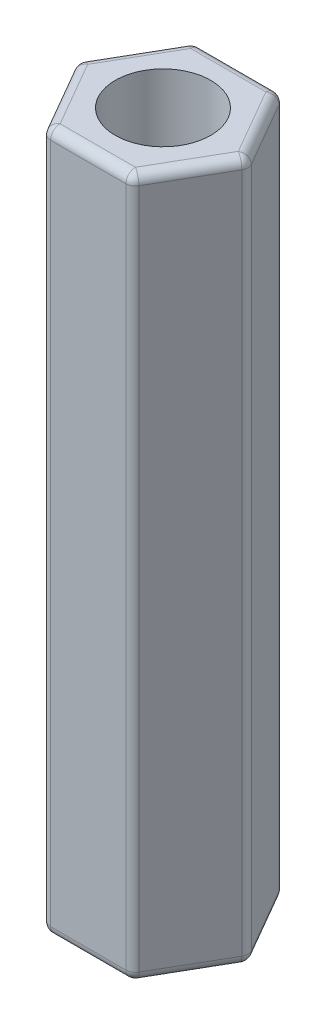
from build123d import *

# Parameters (mm, degrees)
SKETCH_1_R      = 1.5
EXTRUDE_1_DEPTH = 22
FILLET_1_R      = 0.3


with BuildPart() as part:
    # 草图1 → 凸台-拉伸1 (new body)
    with BuildSketch(Plane(origin=(0, 0, 0), x_dir=(1, 0, 0), z_dir=(0, 1, 0))):
        Polygon((2.713546265, 0), (1.356773133, 2.35), (-1.356773133, 2.35), (-2.713546265, 0), (-1.356773133, -2.35), (1.356773133, -2.35), align=None)
        with Locations(Location((0, 0, 0), (0, 0, 270))):
            Circle(SKETCH_1_R, mode=Mode.SUBTRACT)
    extrude(amount=EXTRUDE_1_DEPTH)

    # 圆角1
    fillet_1_edges = [part.edges().sort_by_distance(p)[0] for p in [
        (0, 22, -2.35),
        (1.356773133, 11, 2.35),
        (-1.356773133, 11, 2.35),
        (-2.713546265, 11, 0),
        (-1.356773133, 11, -2.35),
        (1.356773133, 11, -2.35),
        (2.713546265, 11, 0),
        (-2.035159699, 22, -1.175),
        (-2.035159699, 22, 1.175),
        (0, 22, 2.35),
        (2.035159699, 22, 1.175),
        (0, 0, 2.35),
        (-2.035159699, 0, 1.175),
        (-2.035159699, 0, -1.175),
        (2.035159699, 22, -1.175),
        (0, 0, -2.35),
        (2.035159699, 0, -1.175),
        (2.035159699, 0, 1.175),
    ]]
    fillet(fillet_1_edges, radius=FILLET_1_R)


solid = part.part
